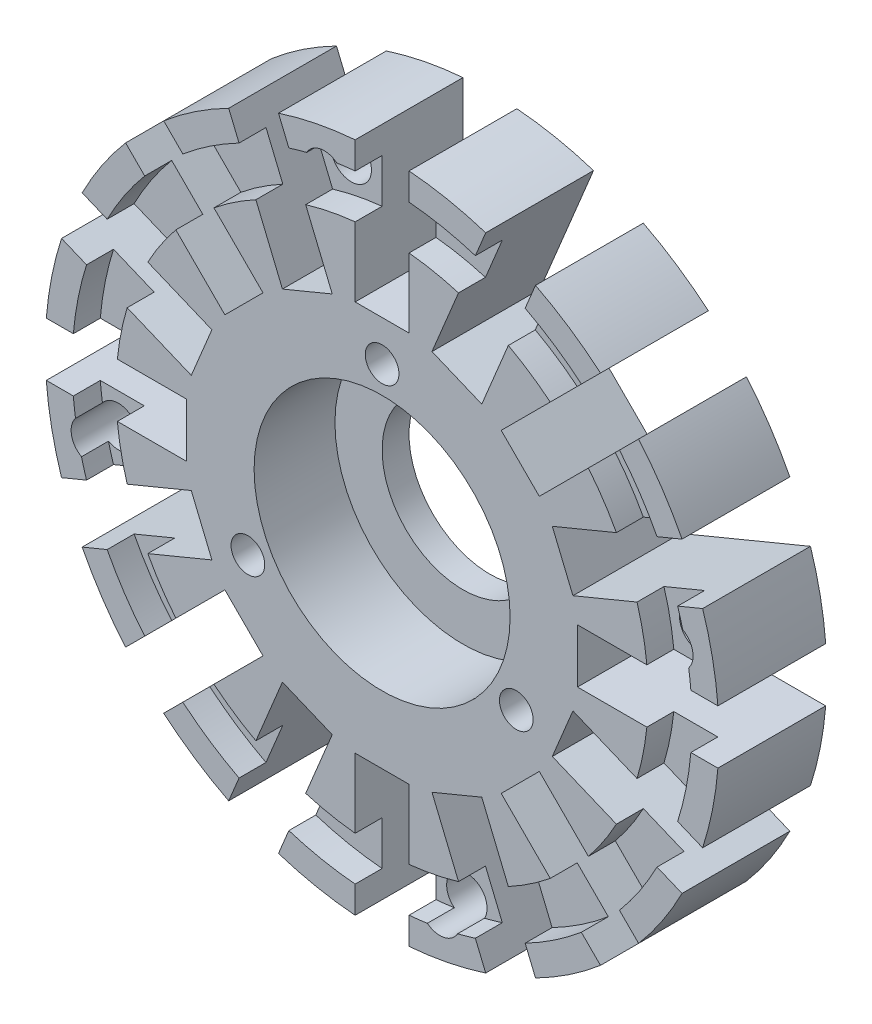
from build123d import *

# Parameters (mm, degrees)
ESBO_O1_R                  = 25
EXTRUS_O1_DEPTH            = 8
EXTRUS_O2_DEPTH            = 8
CIRPATTERN1_COUNT          = 16
CORTE_EXTRUS_O2_DEPTH      = 10
CORTE_EXTRUS_O2_DEPTH_BACK = 37.138621999
ESBO_O5_R                  = 1.25
ESBO_O5_R_2                = 6
ESBO_O8_R                  = 23
ESBO_O8_R_2                = 19.75
CORTE_EXTRUS_O4_DEPTH      = 2
ESBO_O9_R                  = 9.5
CORTE_EXTRUS_O5_DEPTH      = 6
ESBO_O10_R                 = 1.5
CORTE_EXTRUS_O6_DEPTH      = 37.138621999


with BuildPart() as part:
    # Esboço1 → Extrusão1 (new body)
    with BuildSketch(Plane.XY):
        Circle(ESBO_O1_R)
    extrude(amount=-EXTRUS_O1_DEPTH)


with BuildPart() as body_2:
    # Esboço2 → Extrusão2 (new, through all)
    with BuildSketch(Plane(origin=(0, 0, -8), x_dir=(-1, 0, 0), z_dir=(0, 0, -1))):
        Polygon((0, 14.5), (2, 14.5), (2, 29.5), (-2, 29.5), (-2, 14.5), align=None)
    extrude(amount=-EXTRUS_O2_DEPTH)


with BuildPart() as cirpattern1_1:
    # CirPattern1: pattern copy
    add(body_2.part.rotate(Axis((0, 0, 0), (0, 0, 1)), 1 * 360 / CIRPATTERN1_COUNT))


with BuildPart() as cirpattern1_2:
    # CirPattern1: pattern copy
    add(body_2.part.rotate(Axis((0, 0, 0), (0, 0, 1)), 2 * 360 / CIRPATTERN1_COUNT))


with BuildPart() as cirpattern1_3:
    # CirPattern1: pattern copy
    add(body_2.part.rotate(Axis((0, 0, 0), (0, 0, 1)), 3 * 360 / CIRPATTERN1_COUNT))


with BuildPart() as cirpattern1_4:
    # CirPattern1: pattern copy
    add(body_2.part.rotate(Axis((0, 0, 0), (0, 0, 1)), 4 * 360 / CIRPATTERN1_COUNT))


with BuildPart() as cirpattern1_5:
    # CirPattern1: pattern copy
    add(body_2.part.rotate(Axis((0, 0, 0), (0, 0, 1)), 5 * 360 / CIRPATTERN1_COUNT))


with BuildPart() as cirpattern1_6:
    # CirPattern1: pattern copy
    add(body_2.part.rotate(Axis((0, 0, 0), (0, 0, 1)), 6 * 360 / CIRPATTERN1_COUNT))


with BuildPart() as cirpattern1_7:
    # CirPattern1: pattern copy
    add(body_2.part.rotate(Axis((0, 0, 0), (0, 0, 1)), 7 * 360 / CIRPATTERN1_COUNT))


with BuildPart() as cirpattern1_8:
    # CirPattern1: pattern copy
    add(body_2.part.rotate(Axis((0, 0, 0), (0, 0, 1)), 8 * 360 / CIRPATTERN1_COUNT))


with BuildPart() as cirpattern1_9:
    # CirPattern1: pattern copy
    add(body_2.part.rotate(Axis((0, 0, 0), (0, 0, 1)), 9 * 360 / CIRPATTERN1_COUNT))


with BuildPart() as cirpattern1_10:
    # CirPattern1: pattern copy
    add(body_2.part.rotate(Axis((0, 0, 0), (0, 0, 1)), 10 * 360 / CIRPATTERN1_COUNT))


with BuildPart() as cirpattern1_11:
    # CirPattern1: pattern copy
    add(body_2.part.rotate(Axis((0, 0, 0), (0, 0, 1)), 11 * 360 / CIRPATTERN1_COUNT))


with BuildPart() as cirpattern1_12:
    # CirPattern1: pattern copy
    add(body_2.part.rotate(Axis((0, 0, 0), (0, 0, 1)), 12 * 360 / CIRPATTERN1_COUNT))


with BuildPart() as cirpattern1_13:
    # CirPattern1: pattern copy
    add(body_2.part.rotate(Axis((0, 0, 0), (0, 0, 1)), 13 * 360 / CIRPATTERN1_COUNT))


with BuildPart() as cirpattern1_14:
    # CirPattern1: pattern copy
    add(body_2.part.rotate(Axis((0, 0, 0), (0, 0, 1)), 14 * 360 / CIRPATTERN1_COUNT))


with BuildPart() as cirpattern1_15:
    # CirPattern1: pattern copy
    add(body_2.part.rotate(Axis((0, 0, 0), (0, 0, 1)), 15 * 360 / CIRPATTERN1_COUNT))


with BuildPart() as part_1:
    add(part.part)

    # Combinar1: cut CirPattern1_15, body 2, CirPattern1_1, CirPattern1_2, CirPattern1_3, CirPattern1_4, CirPattern1_5, CirPattern1_6, CirPattern1_7, CirPattern1_8, CirPattern1_9, CirPattern1_10, CirPattern1_11, CirPattern1_12, CirPattern1_13, CirPattern1_14
    add(cirpattern1_15.part, mode=Mode.SUBTRACT)
    add(body_2.part, mode=Mode.SUBTRACT)
    add(cirpattern1_1.part, mode=Mode.SUBTRACT)
    add(cirpattern1_2.part, mode=Mode.SUBTRACT)
    add(cirpattern1_3.part, mode=Mode.SUBTRACT)
    add(cirpattern1_4.part, mode=Mode.SUBTRACT)
    add(cirpattern1_5.part, mode=Mode.SUBTRACT)
    add(cirpattern1_6.part, mode=Mode.SUBTRACT)
    add(cirpattern1_7.part, mode=Mode.SUBTRACT)
    add(cirpattern1_8.part, mode=Mode.SUBTRACT)
    add(cirpattern1_9.part, mode=Mode.SUBTRACT)
    add(cirpattern1_10.part, mode=Mode.SUBTRACT)
    add(cirpattern1_11.part, mode=Mode.SUBTRACT)
    add(cirpattern1_12.part, mode=Mode.SUBTRACT)
    add(cirpattern1_13.part, mode=Mode.SUBTRACT)
    add(cirpattern1_14.part, mode=Mode.SUBTRACT)

    # Esboço5 → Corte-extrusão2 (cut, two sides: drawn at the far end of the back side and taken through both)
    with BuildSketch(Plane(origin=(0, 0, -8), x_dir=(-1, 0, 0), z_dir=(0, 0, -1)).offset(-CORTE_EXTRUS_O2_DEPTH_BACK)):
        with Locations(Location((0, 11.5, 0), (0, 0, 180))):
            Circle(ESBO_O5_R)
        with Locations(Location((9.959292144, -5.75, 0), (0, 0, 180))):
            Circle(ESBO_O5_R)
        with Locations(Location((-9.959292144, -5.75, 0), (0, 0, 180))):
            Circle(ESBO_O5_R)
        with Locations(Location((0, 0, 0), (0, 0, 180))):
            Circle(ESBO_O5_R_2)
    extrude(amount=CORTE_EXTRUS_O2_DEPTH + CORTE_EXTRUS_O2_DEPTH_BACK, mode=Mode.SUBTRACT)

    # Esboço8 → Corte-extrusão4 (cut)
    with BuildSketch(Plane.XY):
        Circle(ESBO_O8_R)
        Circle(ESBO_O8_R_2, mode=Mode.SUBTRACT)
    extrude(amount=-CORTE_EXTRUS_O4_DEPTH, mode=Mode.SUBTRACT)

    # Esboço9 → Corte-extrusão5 (cut)
    with BuildSketch(Plane.XY):
        Circle(ESBO_O9_R)
    extrude(amount=-CORTE_EXTRUS_O5_DEPTH, mode=Mode.SUBTRACT)

    # Esboço10 → Corte-extrusão6 (cut, through all)
    with BuildSketch(Plane(origin=(0, 0, -8), x_dir=(-1, 0, 0), z_dir=(0, 0, -1))):
        with Locations((-4.29, -21.577671329)):
            Circle(ESBO_O10_R)
        with Locations((-21.577671329, 4.29)):
            Circle(ESBO_O10_R)
        with Locations((4.29, 21.577671329)):
            Circle(ESBO_O10_R)
        with Locations((21.577671329, -4.29)):
            Circle(ESBO_O10_R)
    extrude(amount=-CORTE_EXTRUS_O6_DEPTH, mode=Mode.SUBTRACT)


solid = part_1.part
